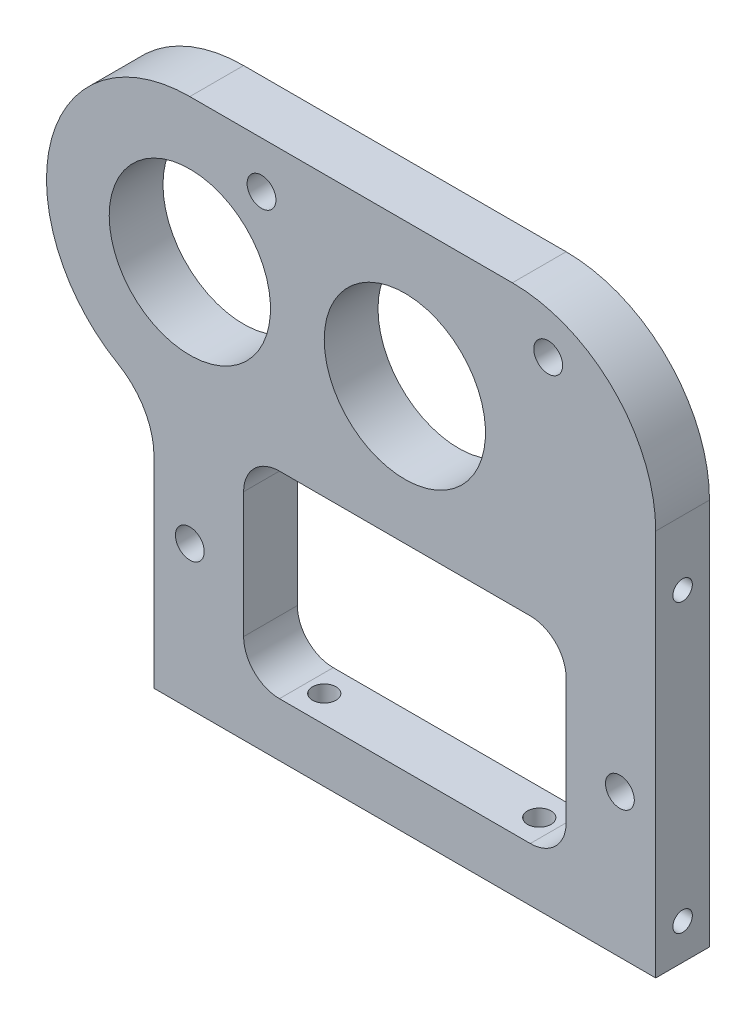
from build123d import *

# Parameters (mm, degrees)
SKETCH1_R                       = 14.2875
BOSS_EXTRUDE1_DEPTH             = 4.7625
F_8_32_TAPPED_HOLE1_D           = 3.4544
F_8_32_TAPPED_HOLE1_DEPTH       = 19.05
F_8_32_TAPPED_HOLE1_CBORE_D     = 4.1656
F_8_32_TAPPED_HOLE1_CBORE_DEPTH = 15.875
F_8_32_TAPPED_HOLE1_TIP         = 1.037806461
F_8_32_TAPPED_HOLE2_D           = 3.4544
F_8_32_TAPPED_HOLE2_DEPTH       = 12.2936
F_8_32_TAPPED_HOLE2_TIP         = 1.037806461
CUT_EXTRUDE2_DEPTH              = 114.820982358
F_8_32_TAPPED_HOLE3_D           = 3.4544
F_8_32_TAPPED_HOLE3_DEPTH       = 12.2936
F_8_32_TAPPED_HOLE3_TIP         = 1.037806461
F_10_CLEARANCE_HOLE1_D          = 5.1054
F_10_CLEARANCE_HOLE1_DEPTH      = 9.525
F_10_CLEARANCE_HOLE1_TIP        = 1.533816902


with BuildPart() as part:
    # Sketch1 → Boss-Extrude1 (new, symmetric)
    with BuildSketch(Plane.XY):
        with BuildLine():
            Line((-44.45, 35.584432116), (-44.45, 0))
            Line((-44.45, 0), (44.45, 0))
            Line((44.45, 0), (44.45, 68.58))
            ThreePointArc((44.45, 68.58), (37.010512242, 86.540512242), (19.05, 93.98))
            Line((19.05, 93.98), (-38.1, 93.98))
            ThreePointArc((-38.1, 93.98), (-62.634515988, 75.154003746), (-50.8, 46.582954744))
            ThreePointArc((-50.8, 46.582954744), (-46.151477372, 41.934432116), (-44.45, 35.584432116))
        make_face()
        with Locations(Location((0, 68.58, 0), (0, 0, 180))):
            Circle(SKETCH1_R, mode=Mode.SUBTRACT)
        with Locations(Location((-38.1, 68.58, 0), (0, 0, 180))):
            Circle(SKETCH1_R, mode=Mode.SUBTRACT)
    extrude(amount=BOSS_EXTRUDE1_DEPTH, both=True)

    # #8-32 Tapped Hole1
    with Locations(Plane.XZ):
        with Locations((-19.05, 0), (19.05, 0)):
            CounterBoreHole(F_8_32_TAPPED_HOLE1_D / 2, F_8_32_TAPPED_HOLE1_CBORE_D / 2, F_8_32_TAPPED_HOLE1_CBORE_DEPTH, depth=F_8_32_TAPPED_HOLE1_DEPTH)
            with Locations((0, 0, -(F_8_32_TAPPED_HOLE1_DEPTH + F_8_32_TAPPED_HOLE1_TIP / 2))):  # 118° drill point
                Cone(0, F_8_32_TAPPED_HOLE1_D / 2, F_8_32_TAPPED_HOLE1_TIP, mode=Mode.SUBTRACT)

    # #8-32 Tapped Hole2
    with Locations(Plane(origin=(-44.45, 3.933791499, -1.696886329), x_dir=(0, 0, 1), z_dir=(-1, 0, 0))):
        with Locations((1.696886329, 15.116208501), (1.696886329, 2.416208501)):
            Hole(F_8_32_TAPPED_HOLE2_D / 2, depth=F_8_32_TAPPED_HOLE2_DEPTH)
            with Locations((0, 0, -(F_8_32_TAPPED_HOLE2_DEPTH + F_8_32_TAPPED_HOLE2_TIP / 2))):  # 118° drill point
                Cone(0, F_8_32_TAPPED_HOLE2_D / 2, F_8_32_TAPPED_HOLE2_TIP, mode=Mode.SUBTRACT)

    # Sketch7 → Cut-Extrude2 (cut, through all)
    with BuildSketch(Plane.XY.offset(4.7625)):
        with BuildLine():
            Line((-22.225, 44.45), (22.225, 44.45))
            ThreePointArc((22.225, 44.45), (26.715128061, 42.590128061), (28.575, 38.1))
            Line((28.575, 38.1), (28.575, 15.875))
            ThreePointArc((28.575, 15.875), (26.715128061, 11.384871939), (22.225, 9.525))
            Line((22.225, 9.525), (-22.225, 9.525))
            ThreePointArc((-22.225, 9.525), (-26.715128061, 11.384871939), (-28.575, 15.875))
            Line((-28.575, 15.875), (-28.575, 38.1))
            ThreePointArc((-28.575, 38.1), (-26.715128061, 42.590128061), (-22.225, 44.45))
        make_face()
    extrude(amount=-CUT_EXTRUDE2_DEPTH, mode=Mode.SUBTRACT)

    # #8-32 Tapped Hole3
    with Locations(Plane(origin=(44.45, 0, 0), x_dir=(0, 0, -1), z_dir=(1, 0, 0))):
        with Locations((0, 6.35), (0, 57.15)):
            Hole(F_8_32_TAPPED_HOLE3_D / 2, depth=F_8_32_TAPPED_HOLE3_DEPTH)
            with Locations((0, 0, -(F_8_32_TAPPED_HOLE3_DEPTH + F_8_32_TAPPED_HOLE3_TIP / 2))):  # 118° drill point
                Cone(0, F_8_32_TAPPED_HOLE3_D / 2, F_8_32_TAPPED_HOLE3_TIP, mode=Mode.SUBTRACT)

    # #10 Clearance Hole1
    with Locations(Plane(origin=(0, 0, -4.7625), x_dir=(-1, 0, 0), z_dir=(0, 0, -1))):
        with Locations((-25.4, 85.725), (25.4, 85.725), (38.1, 25.4), (-38.1, 25.4)):
            Hole(F_10_CLEARANCE_HOLE1_D / 2, depth=F_10_CLEARANCE_HOLE1_DEPTH)
            with Locations((0, 0, -(F_10_CLEARANCE_HOLE1_DEPTH + F_10_CLEARANCE_HOLE1_TIP / 2))):  # 118° drill point
                Cone(0, F_10_CLEARANCE_HOLE1_D / 2, F_10_CLEARANCE_HOLE1_TIP, mode=Mode.SUBTRACT)


solid = part.part
